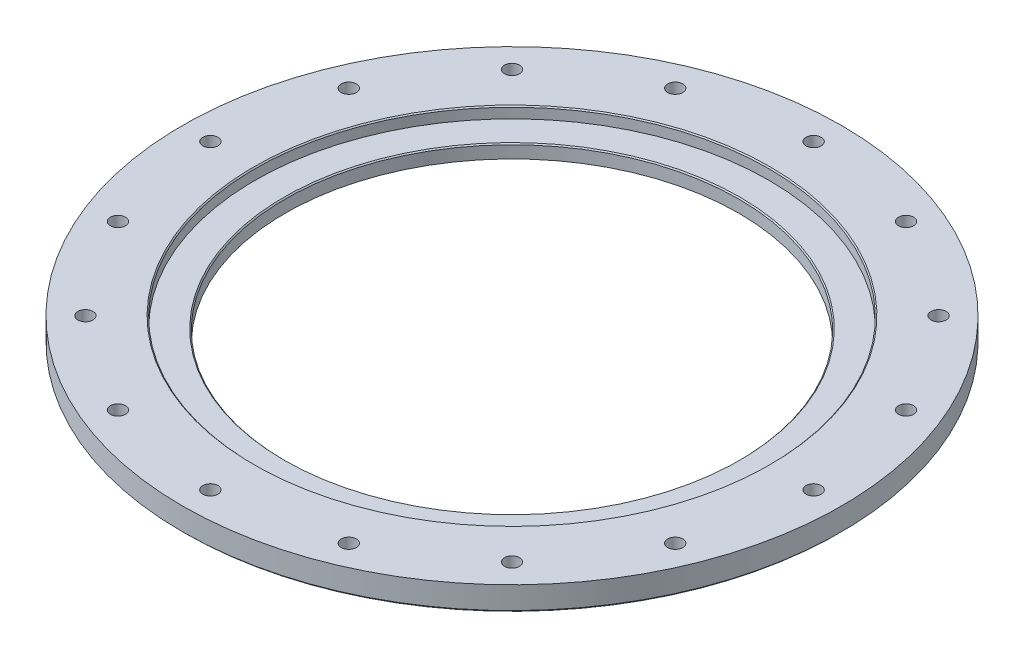
from build123d import *

# Parameters (mm, degrees)
CIRPATTERN1_COUNT = 16
CHAMFER1_SIZE     = 1
CHAMFER2_SIZE     = 2


with BuildPart() as part:
    # Sketch1 → Revolve1 (revolve)
    with BuildSketch(Plane.XY, mode=Mode.PRIVATE) as revolve1_sk:
        Polygon((-203, 0), (-295, 0), (-295, 22), (-230, 22), (-230, 12), (-203, 12), align=None)
    revolve(revolve1_sk.sketch.rotate(Axis((0, 0, 0), (0, 1, 0)), 270), axis=Axis((0, 0, 0), (0, 1, 0)))

    # Sketch4 → CBORE for M12 SHCS1 (revolve, cut)
    with BuildSketch(Plane(origin=(0, 0, 270), x_dir=(0, 0, -1), z_dir=(1, 0, 0))):
        Polygon((0, 0), (0, 22), (6.75, 22), (6.75, 10), (10, 10), (10, 0.025), (10.025, 0), align=None)
    cbore_for_m12_shcs1 = revolve(axis=Axis((0, -6.35, 270), (0, 1, 0)), mode=Mode.SUBTRACT)

    # CirPattern1: CBORE for M12 SHCS1 ×16 about axis
    cirpattern1_axis = Axis((0, 0, 0), (0, 1, 0))
    for i in range(1, CIRPATTERN1_COUNT):
        add(cbore_for_m12_shcs1.rotate(cirpattern1_axis, i * 360 / CIRPATTERN1_COUNT), mode=Mode.SUBTRACT)

    # Chamfer1
    chamfer1_edges = [part.edges().sort_by_distance(p)[0] for p in [
        (0, 12, 203),
        (0, 22, 230),
    ]]
    chamfer(chamfer1_edges, length=CHAMFER1_SIZE)

    # Chamfer2
    chamfer2_edges = [part.edges().sort_by_distance(p)[0] for p in [
        (0, 0, 295),
    ]]
    chamfer(chamfer2_edges, length=CHAMFER2_SIZE)


solid = part.part
